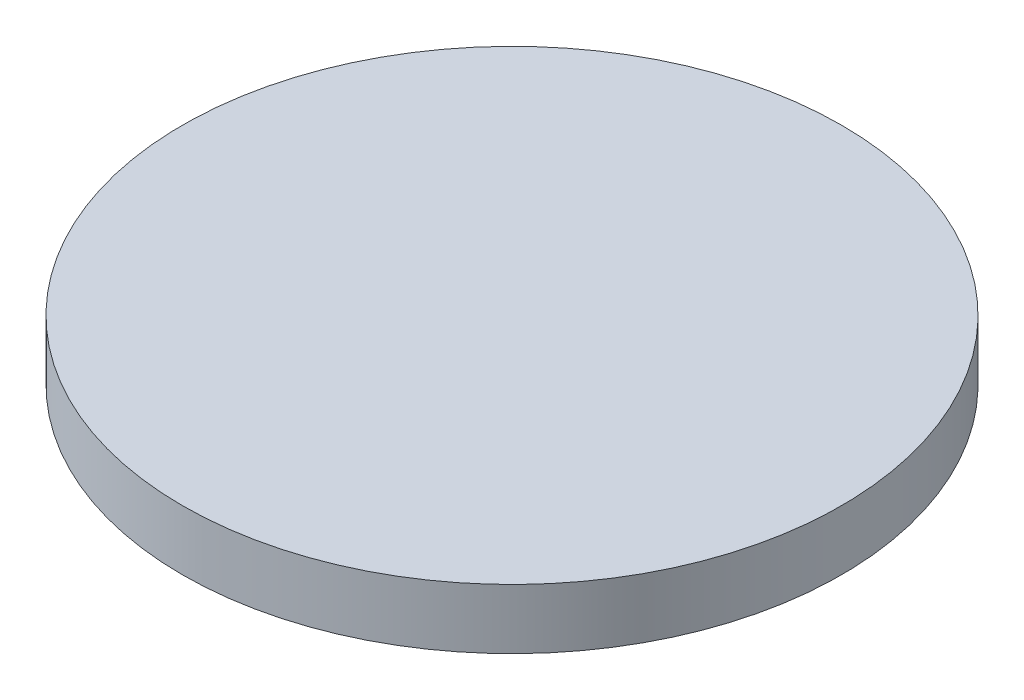
from build123d import *

# Parameters (mm, degrees)
SKETCH1_R           = 0.55
BOSS_EXTRUDE1_DEPTH = 0.1


with BuildPart() as part:
    # Sketch1 → Boss-Extrude1 (new body)
    with BuildSketch(Plane(origin=(0, 0, 0), x_dir=(1, 0, 0), z_dir=(0, 1, 0))):
        with Locations(Location((0, 0, 0), (0, 0, 270))):
            Circle(SKETCH1_R)
    extrude(amount=BOSS_EXTRUDE1_DEPTH)


solid = part.part
